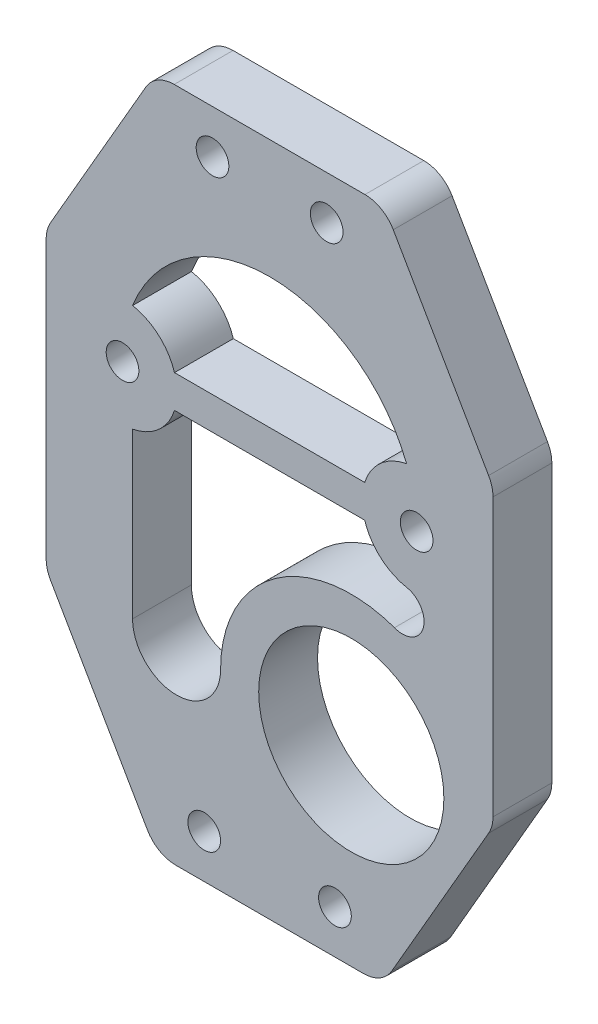
from build123d import *

# Parameters (mm, degrees)
SKETCH1_R           = 1.5
SKETCH1_R_2         = 8.5
BOSS_EXTRUDE1_DEPTH = 2.7
FILLET1_R           = 3
SCALE1_SCALE        = 1.9


with BuildPart() as part:
    # Sketch1 → Boss-Extrude1 (new, symmetric)
    with BuildSketch(Plane.XY):
        with BuildLine():
            Line((10.487675588, 31), (-10.487675588, 31))
            Line((-10.487675588, 31), (-20.108076211, 14.336977332))
            ThreePointArc((-20.108076211, 14.336977332), (-20.407777479, 13.613434467), (-20.51, 12.836977332))
            Line((-20.51, 12.836977332), (-20.51, -12.596152423))
            ThreePointArc((-20.51, -12.596152423), (-20.407777479, -13.372609558), (-20.108076211, -14.096152423))
            Line((-20.108076211, -14.096152423), (-10.348635262, -31))
            Line((-10.348635262, -31), (10.348635262, -31))
            Line((10.348635262, -31), (20.108076211, -14.096152423))
            ThreePointArc((20.108076211, -14.096152423), (20.407777479, -13.372609558), (20.51, -12.596152423))
            Line((20.51, -12.596152423), (20.51, 12.836977332))
            ThreePointArc((20.51, 12.836977332), (20.407777479, 13.613434467), (20.108076211, 14.336977332))
            Line((20.108076211, 14.336977332), (10.487675588, 31))
        make_face()
        with Locations(Location((-6, -27, 0), (0, 0, 180))):
            Circle(SKETCH1_R, mode=Mode.SUBTRACT)
        with Locations(Location((6, -27, 0), (0, 0, 180))):
            Circle(SKETCH1_R, mode=Mode.SUBTRACT)
        with Locations(Location((7.5, -13.4, 0), (0, 0, 180))):
            Circle(SKETCH1_R_2, mode=Mode.SUBTRACT)
        with BuildLine():
            ThreePointArc((-4.5, -13.4), (-8.54, -17.44), (-12.58, -13.4))
            Line((-12.58, -13.4), (-12.58, 1.685368783))
            ThreePointArc((-12.58, 1.685368783), (-10.18215631, 2.859423407), (-8.730303993, 5.1))
            Line((-8.730303993, 5.1), (8.729875369, 5.1))
            ThreePointArc((8.729875369, 5.1), (10.179804764, 2.860963681), (12.574584064, 1.685969643))
            ThreePointArc((12.574584064, 1.685969643), (14.121431526, -0.726790857), (11.622623122, -2.13039581))
            ThreePointArc((11.622623122, -2.13039581), (11.545720037, -2.104624526), (11.469942926, -2.075709596))
            ThreePointArc((11.469942926, -2.075709596), (0.558793877, -3.611248417), (-4.5, -13.4))
        make_face(mode=Mode.SUBTRACT)
        with Locations(Location((-13.5, 6.6, 0), (0, 0, 180))):
            Circle(SKETCH1_R, mode=Mode.SUBTRACT)
        with BuildLine():
            Line((8.729875369, 8.1), (-8.730303993, 8.1))
            ThreePointArc((-8.730303993, 8.1), (-10.179901517, 10.338575405), (-12.574074074, 11.513518208))
            ThreePointArc((-12.574074074, 11.513518208), (-0.00020804, 20.099999998), (12.57392263, 11.513905748))
            ThreePointArc((12.57392263, 11.513905748), (10.179553129, 10.338812856), (8.729875369, 8.1))
        make_face(mode=Mode.SUBTRACT)
        with Locations(Location((-5.24, 27, 0), (0, 0, 180))):
            Circle(SKETCH1_R, mode=Mode.SUBTRACT)
        with Locations(Location((13.5, 6.6, 0), (0, 0, 180))):
            Circle(SKETCH1_R, mode=Mode.SUBTRACT)
        with Locations(Location((5.24, 27, 0), (0, 0, 180))):
            Circle(SKETCH1_R, mode=Mode.SUBTRACT)
    extrude(amount=BOSS_EXTRUDE1_DEPTH, both=True)

    # Fillet1
    fillet1_edges = [part.edges().sort_by_distance(p)[0] for p in [
        (-10.487675588, 31, 0),
        (10.487675588, 31, 0),
        (10.348635262, -31, 0),
        (-10.348635262, -31, 0),
    ]]
    fillet(fillet1_edges, radius=FILLET1_R)


with BuildPart() as part_1:
    # Scale1: scaled about (-0.489793852, 0.73928426, 0)
    add(part.part.scale(SCALE1_SCALE).moved(Location((0.440814467, -0.665355834, 0))))


solid = part_1.part
